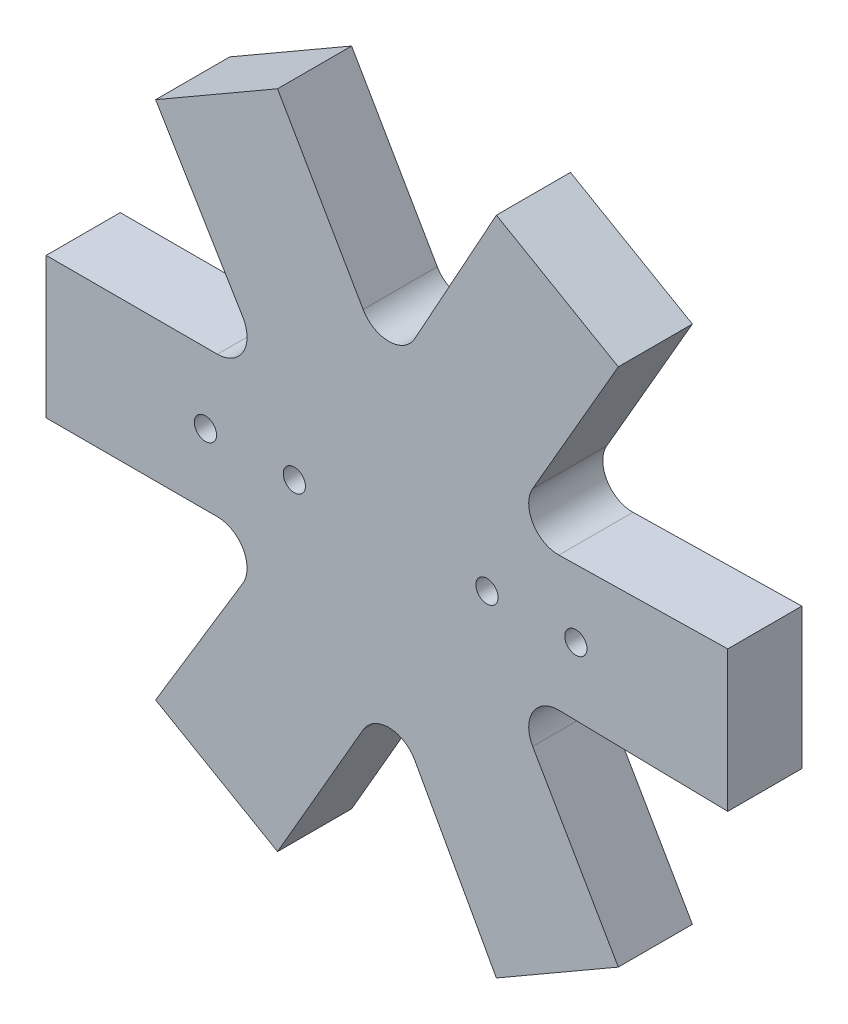
from build123d import *

# Parameters (mm, degrees)
BOSS_EXTRUDE2_DEPTH = 5
CUT_EXTRUDE1_DEPTH  = 2
SKETCH3_R           = 0.75
CUT_EXTRUDE2_DEPTH  = 33.350678515


with BuildPart() as part:
    # Sketch1 → Boss-Extrude2 (new body)
    with BuildSketch(Plane.XY):
        with BuildLine():
            Line((-23.25, 4.75), (-23.25, -4.75))
            Line((-23.25, -4.75), (-11.691342951, -4.75))
            ThreePointArc((-11.691342951, -4.75), (-9.949887623, -5.766468943), (-9.978567551, -7.78266666))
            Line((-9.978567551, -7.78266666), (-15.863620668, -17.543584287))
            Line((-15.863620668, -17.543584287), (-7.636379332, -22.293584287))
            Line((-7.636379332, -22.293584287), (-1.857050808, -12.283493649))
            ThreePointArc((-1.857050808, -12.283493649), (-0.106035217, -11.283583567), (1.625703261, -12.316519972))
            Line((1.625703261, -12.316519972), (7.136379332, -22.293584287))
            Line((7.136379332, -22.293584287), (15.363620668, -17.543584287))
            Line((15.363620668, -17.543584287), (9.584292144, -7.533493649))
            ThreePointArc((9.584292144, -7.533493649), (9.593852406, -5.517114624), (11.354270812, -4.533853312))
            Line((11.354270812, -4.533853312), (22.75, -4.75))
            Line((22.75, -4.75), (22.75, 4.75))
            Line((22.75, 4.75), (11.354270812, 4.533853312))
            ThreePointArc((11.354270812, 4.533853312), (9.593852406, 5.517114624), (9.584292144, 7.533493649))
            Line((9.584292144, 7.533493649), (15.363620668, 17.543584287))
            Line((15.363620668, 17.543584287), (7.136379332, 22.293584287))
            Line((7.136379332, 22.293584287), (1.625703261, 12.316519972))
            ThreePointArc((1.625703261, 12.316519972), (-0.106035217, 11.283583567), (-1.857050808, 12.283493649))
            Line((-1.857050808, 12.283493649), (-7.636379332, 22.293584287))
            Line((-7.636379332, 22.293584287), (-15.863620668, 17.543584287))
            Line((-15.863620668, 17.543584287), (-9.978567551, 7.78266666))
            ThreePointArc((-9.978567551, 7.78266666), (-9.949887623, 5.766468943), (-11.691342951, 4.75))
            Line((-11.691342951, 4.75), (-23.25, 4.75))
        make_face()
    extrude(amount=BOSS_EXTRUDE2_DEPTH)

    # Sketch2 → Cut-Extrude1 (cut)
    with BuildSketch(Plane(origin=(0, 0, 0), x_dir=(-1, 0, 0), z_dir=(0, 0, -1))):
        with BuildLine():
            Line((0.780612245, 4.177696078), (12.617346939, 1.965974625))
            ThreePointArc((12.617346939, 1.965974625), (14.25, 0), (12.617346939, -1.965974625))
            Line((12.617346939, -1.965974625), (0.780612245, -4.177696078))
            ThreePointArc((0.780612245, -4.177696078), (0, -4.25), (-0.780612245, -4.177696078))
            Line((-0.780612245, -4.177696078), (-12.617346939, -1.965974625))
            ThreePointArc((-12.617346939, -1.965974625), (-14.25, 0), (-12.617346939, 1.965974625))
            Line((-12.617346939, 1.965974625), (-0.780612245, 4.177696078))
            ThreePointArc((-0.780612245, 4.177696078), (0, 4.25), (0.780612245, 4.177696078))
        make_face()
    extrude(amount=-CUT_EXTRUDE1_DEPTH, mode=Mode.SUBTRACT)

    # Sketch3 → Cut-Extrude2 (cut, through all)
    with BuildSketch(Plane(origin=(0, 0, 2), x_dir=(-1, 0, 0), z_dir=(0, 0, -1))):
        with Locations((-6.5, 0)):
            Circle(SKETCH3_R)
        with Locations((-12.5, 0)):
            Circle(SKETCH3_R)
        with Locations(Location((6.5, 0, 0), (0, 0, 180))):
            Circle(SKETCH3_R)
        with Locations(Location((12.5, 0, 0), (0, 0, 180))):
            Circle(SKETCH3_R)
    extrude(amount=-CUT_EXTRUDE2_DEPTH, mode=Mode.SUBTRACT)


solid = part.part
